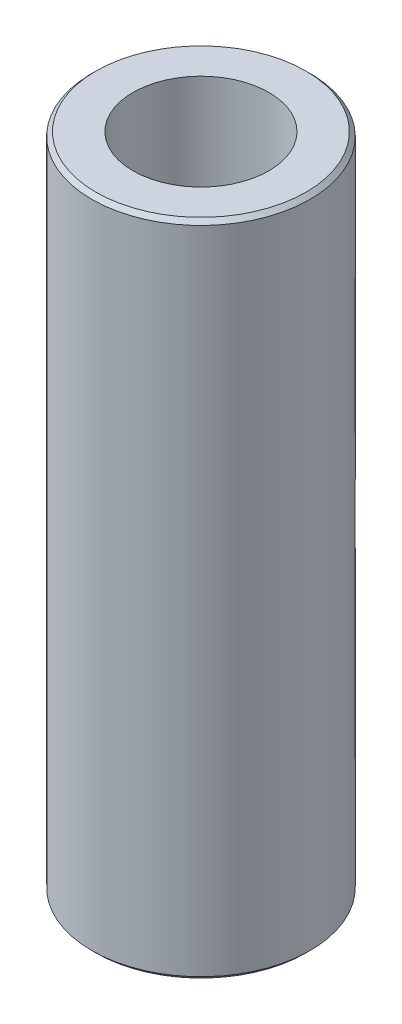
from build123d import *

# Parameters (mm, degrees)
IZIM1_R                     = 2.65
IZIM1_R_2                   = 1.65
Y_KSEKLIK_EKSTR_ZYON1_DEPTH = 16
PAH1_SIZE                   = 0.1
IZIM2_R                     = 2.5
KES_EKSTR_ZYON1_DEPTH       = 8.8


with BuildPart() as part:
    # Çizim1 → Yükseklik-Ekstrüzyon1 (new body)
    with BuildSketch(Plane(origin=(0, 0, 0), x_dir=(1, 0, 0), z_dir=(0, 1, 0))):
        with Locations(Location((0, 0, 0), (0, 0, 270))):
            Circle(IZIM1_R)
        with Locations(Location((0, 0, 0), (0, 0, 270))):
            Circle(IZIM1_R_2, mode=Mode.SUBTRACT)
    extrude(amount=Y_KSEKLIK_EKSTR_ZYON1_DEPTH)

    # Pah1
    pah1_edges = [part.edges().sort_by_distance(p)[0] for p in [
        (0, 0, -2.65),
        (0, 16, -2.65),
    ]]
    chamfer(pah1_edges, length=PAH1_SIZE)

    # Çizim2 → Kes-Ekstrüzyon1 (cut, symmetric)
    with BuildSketch(Plane(origin=(0, 0, 0), x_dir=(0, 0, -1), z_dir=(1, 0, 0))):
        with Locations((4.25, 8)):
            Circle(IZIM2_R)
    extrude(amount=KES_EKSTR_ZYON1_DEPTH, both=True, mode=Mode.SUBTRACT)


solid = part.part
